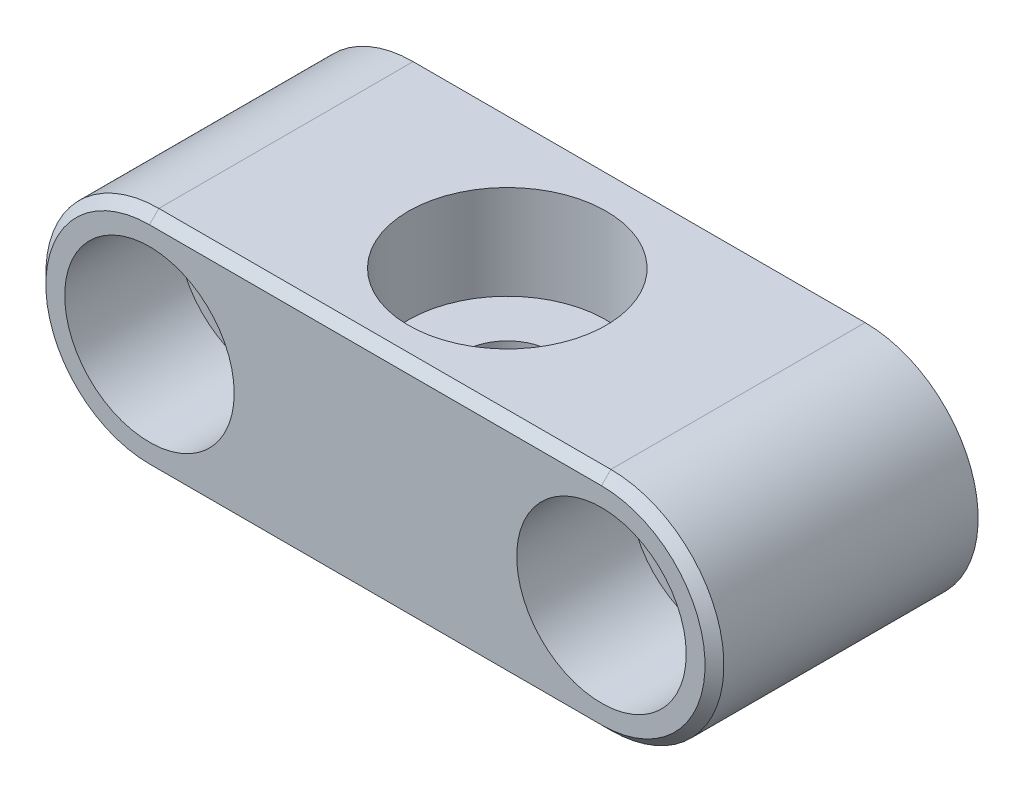
from build123d import *

# Parameters (mm, degrees)
SKETCH1_R           = 2.75
BOSS_EXTRUDE1_DEPTH = 7
SKETCH2_R           = 2.35
CUT_EXTRUDE1_DEPTH  = 23.737634002
SKETCH3_R           = 5.25
CUT_EXTRUDE2_DEPTH  = 5
CHAMFER1_SIZE       = 0.5
SKETCH4_R           = 4.5
CUT_EXTRUDE3_DEPTH  = 6


with BuildPart() as part:
    # Sketch1 → Boss-Extrude1 (new, symmetric)
    with BuildSketch(Plane.XY):
        with BuildLine():
            Line((12, -6), (-12, -6))
            ThreePointArc((-12, -6), (-18, 0), (-12, 6))
            Line((-12, 6), (12, 6))
            ThreePointArc((12, 6), (18, 0), (12, -6))
        make_face()
        with Locations((-12, 0)):
            Circle(SKETCH1_R, mode=Mode.SUBTRACT)
        with Locations((12, 0)):
            Circle(SKETCH1_R, mode=Mode.SUBTRACT)
    extrude(amount=BOSS_EXTRUDE1_DEPTH, both=True)

    # Sketch2 → Cut-Extrude1 (cut, through all)
    with BuildSketch(Plane(origin=(0, 6, 0), x_dir=(1, 0, 0), z_dir=(0, 1, 0))):
        with Locations(Location((0, 0, 0), (0, 0, 180))):
            Circle(SKETCH2_R)
    extrude(amount=-CUT_EXTRUDE1_DEPTH, mode=Mode.SUBTRACT)

    # Sketch3 → Cut-Extrude2 (cut)
    with BuildSketch(Plane(origin=(0, 6, 0), x_dir=(1, 0, 0), z_dir=(0, 1, 0))):
        with Locations(Location((0, 0, 0), (0, 0, 180))):
            Circle(SKETCH3_R)
    extrude(amount=-CUT_EXTRUDE2_DEPTH, mode=Mode.SUBTRACT)

    # Chamfer1
    chamfer1_edges = [part.edges().sort_by_distance(p)[0] for p in [
        (-18, 0, 7),
        (0, -6, 7),
        (18, 0, 7),
        (0, 6, 7),
    ]]
    chamfer(chamfer1_edges, length=CHAMFER1_SIZE)

    # Sketch4 → Cut-Extrude3 (cut)
    with BuildSketch(Plane.XY.offset(7)):
        with Locations((-12, 0)):
            Circle(SKETCH4_R)
        with Locations((12, 0)):
            Circle(SKETCH4_R)
    extrude(amount=-CUT_EXTRUDE3_DEPTH, mode=Mode.SUBTRACT)


solid = part.part
